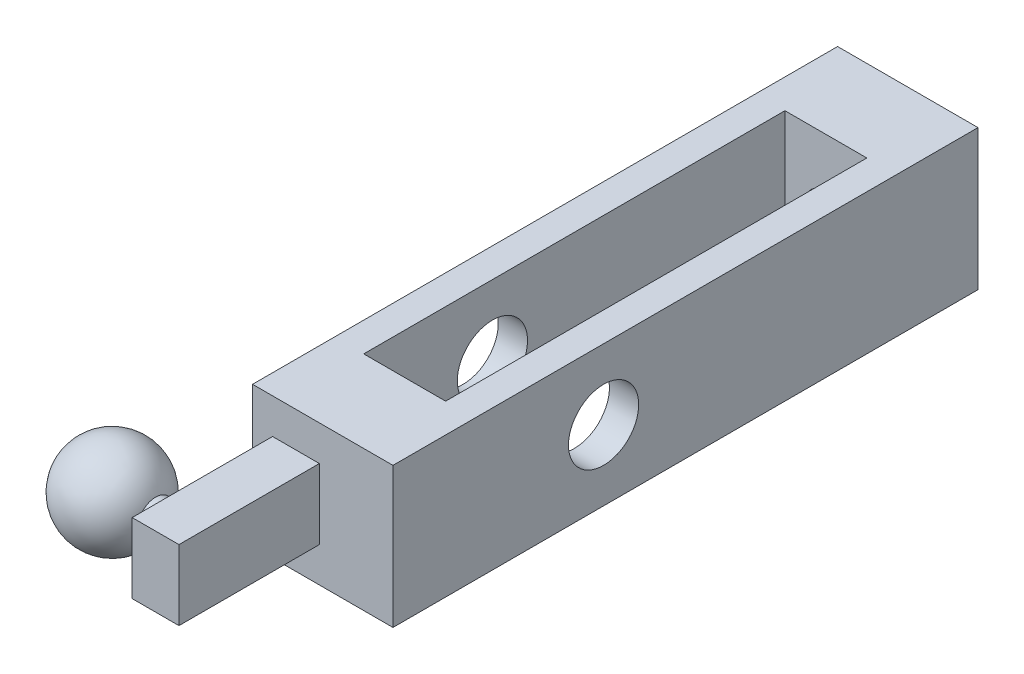
from build123d import *

# Parameters (mm, degrees)
SKETCH_1_W          = 6
SKETCH_1_H          = 6
EXTRUDE_1_DEPTH     = 25
SKETCH_2_W          = 2
SKETCH_2_H          = 3
EXTRUDE_2_DEPTH     = 6
SKETCH_3_R          = 0.75
EXTRUDE_3_DEPTH     = 1
SKETCH_5_W          = 18
SKETCH_5_H          = 3.5
CUT_EXTRUDE_1_DEPTH = 8
SKETCH_6_R          = 1.5
CUT_EXTRUDE_2_DEPTH = 8
SKETCH_7_R          = 0.9
CUT_EXTRUDE_3_DEPTH = 8


with BuildPart() as part:
    # 草图1 → 凸台-拉伸1 (new body)
    with BuildSketch(Plane.XY):
        Rectangle(SKETCH_1_W, SKETCH_1_H)
    extrude(amount=EXTRUDE_1_DEPTH)

    # 草图2 → 凸台-拉伸2 (add)
    with BuildSketch(Plane.XY.offset(25)):
        with Locations((-1.14479355, -0.004540815)):
            Rectangle(SKETCH_2_W, SKETCH_2_H)
    extrude(amount=EXTRUDE_2_DEPTH)

    # 草图3 → 凸台-拉伸3 (add)
    with BuildSketch(Plane.ZY.offset(2.14479355)):
        with Locations(Location((29, 0, 0), (0, 0, 90))):
            Circle(SKETCH_3_R)
    extrude(amount=EXTRUDE_3_DEPTH)

    # 草图4 → 旋转1 (revolve)
    with BuildSketch(Plane(origin=(0, 0, 0), x_dir=(1, 0, 0), z_dir=(0, 1, 0))):
        with BuildLine():
            Line((-3.14479355, -29), (-6.998843172, -29))
            ThreePointArc((-6.998843172, -29), (-5.380877697, -27.036826645), (-3.14479355, -28.25))
            Line((-3.14479355, -28.25), (-3.14479355, -29))
        make_face()
    revolve(axis=Axis((-3.14479355, 0, 29), (-1, 0, 0)))

    # 草图5 → 切除-拉伸1 (cut)
    with BuildSketch(Plane(origin=(0.5, 3, 0), x_dir=(0, 0, 1), z_dir=(0, -1, 0))):
        with Locations((12.5, 0.5)):
            Rectangle(SKETCH_5_W, SKETCH_5_H)
    extrude(amount=CUT_EXTRUDE_1_DEPTH, mode=Mode.SUBTRACT)

    # 草图6 → 切除-拉伸2 (cut)
    with BuildSketch(Plane.ZY.offset(3)):
        with Locations((16, 0)):
            Circle(SKETCH_6_R)
    extrude(amount=-CUT_EXTRUDE_2_DEPTH, mode=Mode.SUBTRACT)

    # 草图7 → 切除-拉伸3 (cut)
    with BuildSketch(Plane(origin=(0, 0, 0), x_dir=(-1, 0, 0), z_dir=(0, 0, -1))):
        Circle(SKETCH_7_R)
    extrude(amount=-CUT_EXTRUDE_3_DEPTH, mode=Mode.SUBTRACT)


solid = part.part
